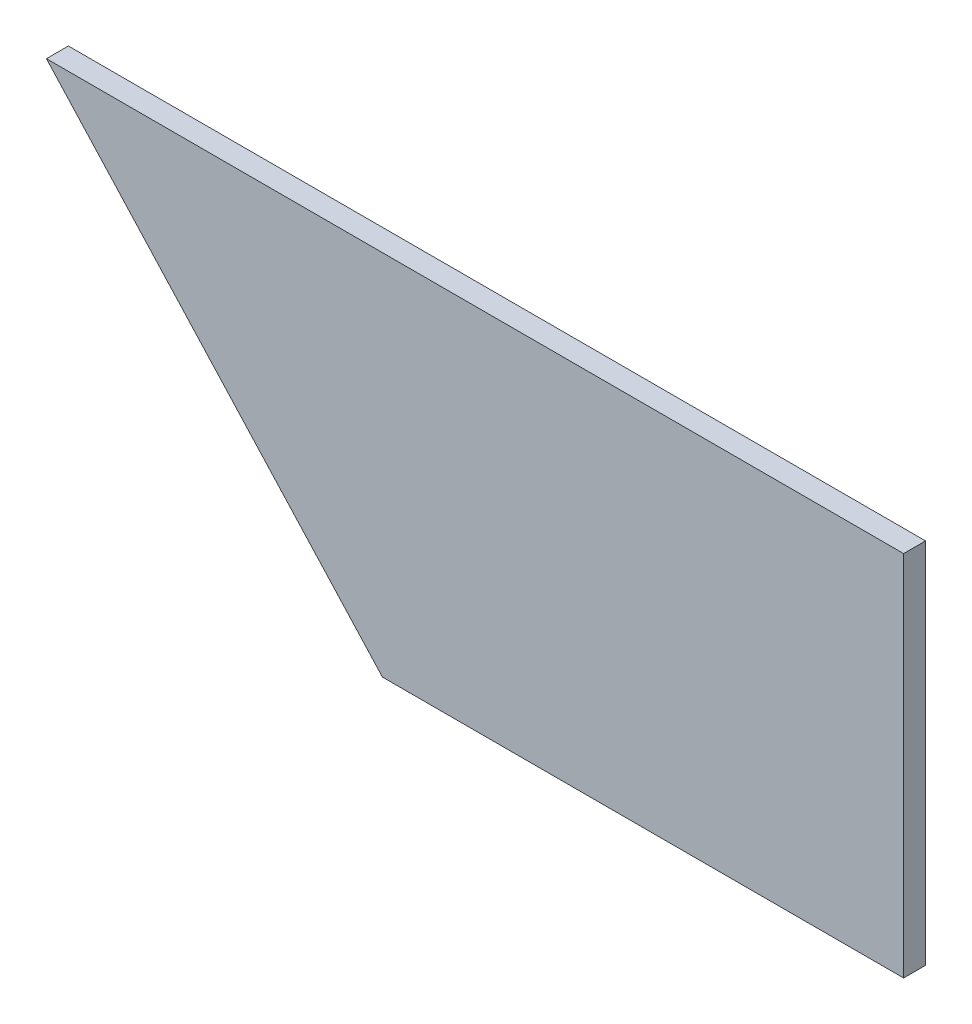
from build123d import *

# Parameters (mm, degrees)
EXTRUDE_1_DEPTH = 16


with BuildPart() as part:
    # 草图1 → 凸台-拉伸1 (new body)
    with BuildSketch(Plane.XY):
        Polygon((0, 0), (380, 0), (380, 268), (-245, 268), align=None)
    extrude(amount=EXTRUDE_1_DEPTH)


solid = part.part
